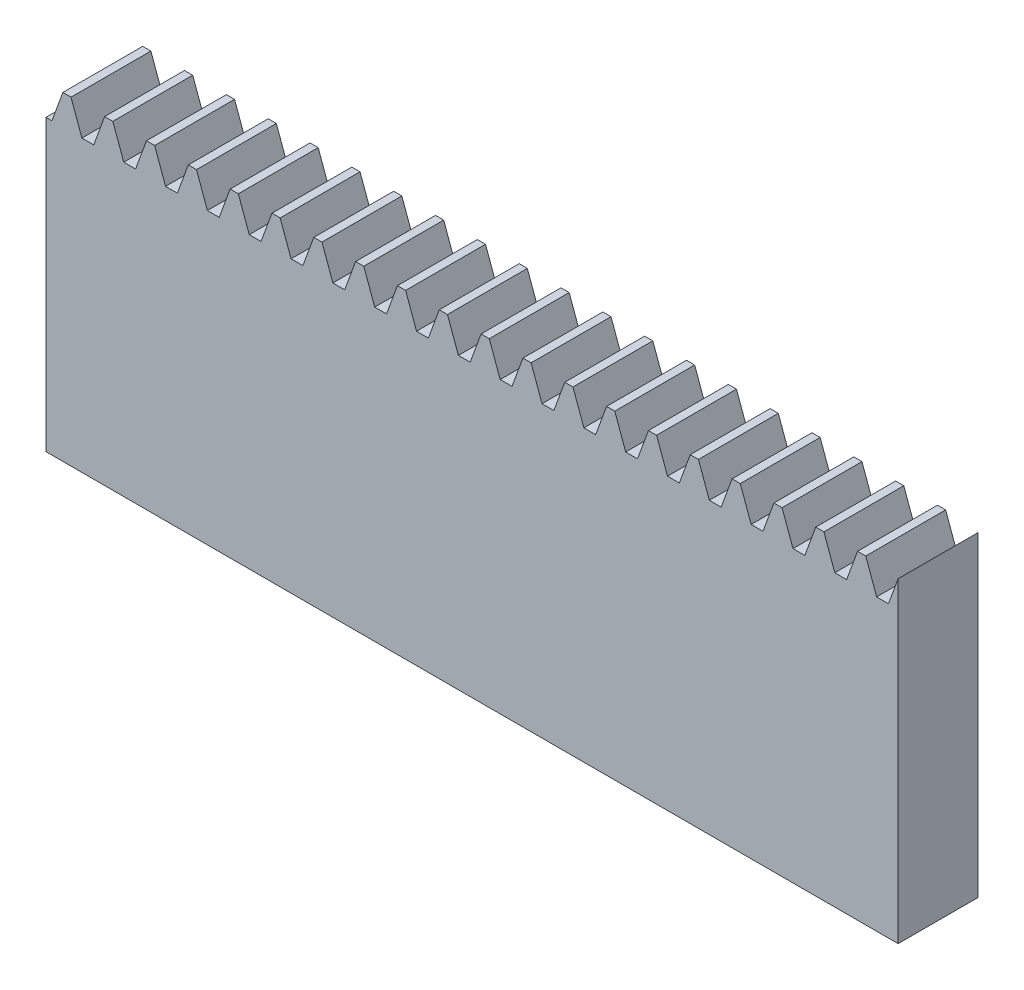
from build123d import *

# Parameters (mm, degrees)
BLANKSKE_W        = 32
BLANKSKE_H        = 12
BLANK_DEPTH       = 3
TOOTHCUTSIM_DEPTH = 35.307433597
TEETHCUTS_COUNT   = 21
TEETHCUTS_PITCH   = 1.570796325


with BuildPart() as part:
    # BlankSke → Blank (new body)
    with BuildSketch(Plane.XY):
        with Locations((16, 6)):
            Rectangle(BLANKSKE_W, BLANKSKE_H)
    extrude(amount=-BLANK_DEPTH)

    # TooCutSkeSim → ToothCutSim (cut, through all)
    with BuildSketch(Plane.XY):
        Polygon((0.222217685, 10.875), (-0.222217685, 10.875), (-0.640929042, 12.0254), (0.640929042, 12.0254), align=None)
    toothcutsim = extrude(amount=-TOOTHCUTSIM_DEPTH, mode=Mode.SUBTRACT)

    # TeethCuts: ToothCutSim ×21
    with Locations(*[(i * TEETHCUTS_PITCH, 0, 0) for i in range(1, TEETHCUTS_COUNT)]):
        add(toothcutsim, mode=Mode.SUBTRACT)


solid = part.part
